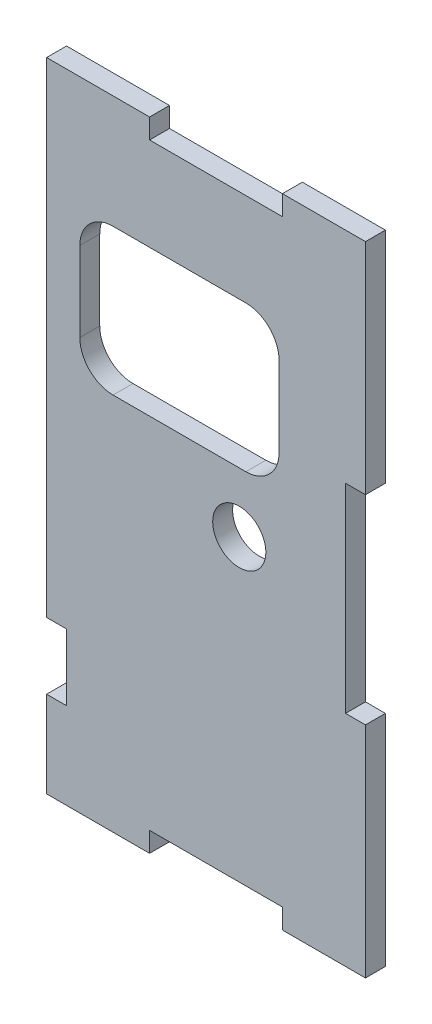
from build123d import *

# Parameters (mm, degrees)
BOSS_EXTRUDE1_DEPTH = 3
SKETCH2_W           = 3
SKETCH2_H           = 10
CUT_EXTRUDE1_DEPTH  = 108.373181009
SKETCH3_R           = 4
CUT_EXTRUDE2_DEPTH  = 108.373181009
SKETCH4_W           = 3
SKETCH4_H           = 30
CUT_EXTRUDE3_DEPTH  = 108.373181009
CUT_EXTRUDE4_DEPTH  = 108.373181009


with BuildPart() as part:
    # Sketch1 → Boss-Extrude1 (new body)
    with BuildSketch(Plane.XY):
        Polygon((0, 0), (0, 96), (15.5, 96), (15.5, 93), (35.5, 93), (35.5, 96), (48, 96), (48, 0), (35.5, 0), (35.5, 3), (15.5, 3), (15.5, 0), align=None)
    extrude(amount=BOSS_EXTRUDE1_DEPTH)

    # Sketch2 → Cut-Extrude1 (cut, through all)
    with BuildSketch(Plane.XY.offset(3)):
        with Locations((1.5, 18)):
            Rectangle(SKETCH2_W, SKETCH2_H)
    extrude(amount=-CUT_EXTRUDE1_DEPTH, mode=Mode.SUBTRACT)

    # Sketch3 → Cut-Extrude2 (cut, through all)
    with BuildSketch(Plane(origin=(0, 0, 0), x_dir=(-1, 0, 0), z_dir=(0, 0, -1))):
        with Locations((-29, 48)):
            Circle(SKETCH3_R)
    extrude(amount=-CUT_EXTRUDE2_DEPTH, mode=Mode.SUBTRACT)

    # Sketch4 → Cut-Extrude3 (cut, through all)
    with BuildSketch(Plane(origin=(0, 0, 0), x_dir=(-1, 0, 0), z_dir=(0, 0, -1))):
        with Locations((-46.5, 48)):
            Rectangle(SKETCH4_W, SKETCH4_H)
    extrude(amount=-CUT_EXTRUDE3_DEPTH, mode=Mode.SUBTRACT)

    # Sketch5 → Cut-Extrude4 (cut, through all)
    with BuildSketch(Plane(origin=(0, 0, 0), x_dir=(-1, 0, 0), z_dir=(0, 0, -1))):
        with BuildLine():
            Line((-10, 57), (-30, 57))
            ThreePointArc((-30, 57), (-33.535533906, 58.464466094), (-35, 62))
            Line((-35, 62), (-35, 74))
            ThreePointArc((-35, 74), (-33.535533906, 77.535533906), (-30, 79))
            Line((-30, 79), (-10, 79))
            ThreePointArc((-10, 79), (-6.464466094, 77.535533906), (-5, 74))
            Line((-5, 74), (-5, 62))
            ThreePointArc((-5, 62), (-6.464466094, 58.464466094), (-10, 57))
        make_face()
    extrude(amount=-CUT_EXTRUDE4_DEPTH, mode=Mode.SUBTRACT)


solid = part.part
